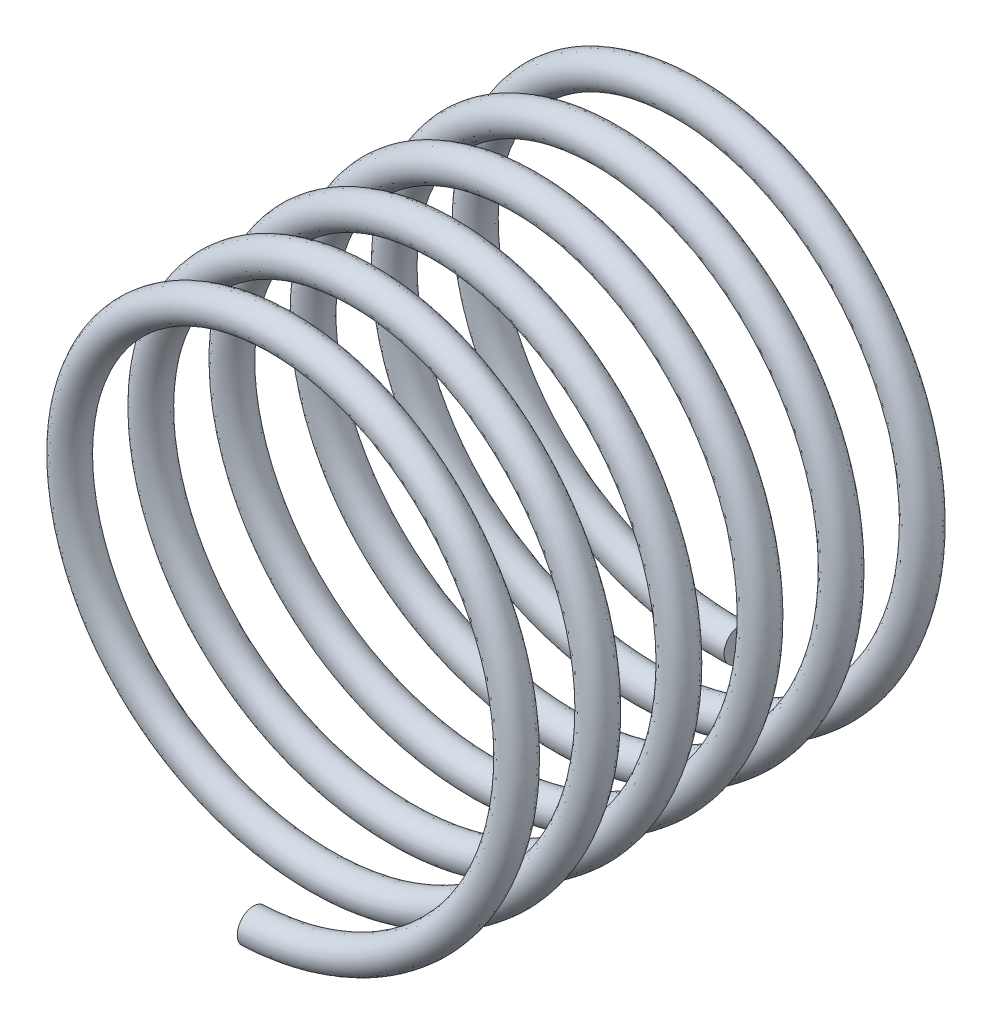
from build123d import *

# Parameters (mm, degrees)
SWEEP1_PITCH       = 0.5
SWEEP1_HEIGHT      = 3
SWEEP1_RADIUS      = 1.5
SWEEP1_START_ANGLE = -90
SWEEP1_PROFILE_R   = 0.1


with BuildPart() as part:
    # Sweep1: sweep along a helix
    with BuildLine() as sweep1_path:
        add(Helix(SWEEP1_PITCH, SWEEP1_HEIGHT, SWEEP1_RADIUS, center=(0, 0, 0), direction=(0, 0, 1), lefthand=True, mode=Mode.PRIVATE).rotate(Axis((0, 0, 0), (0, 0, 1)), SWEEP1_START_ANGLE))
    # Sweep1 profile (on start of the path) → Sweep1 (sweep)
    with BuildSketch(Plane(origin=(0, -1.5, 0), x_dir=(-0.052977148587756054, 0, -0.9985957248694343), z_dir=(-0.9985957248694343, -3.650914021361518e-13, 0.052977148587756054))):
        Circle(SWEEP1_PROFILE_R)
    sweep(path=sweep1_path.line, is_frenet=True)


solid = part.part
